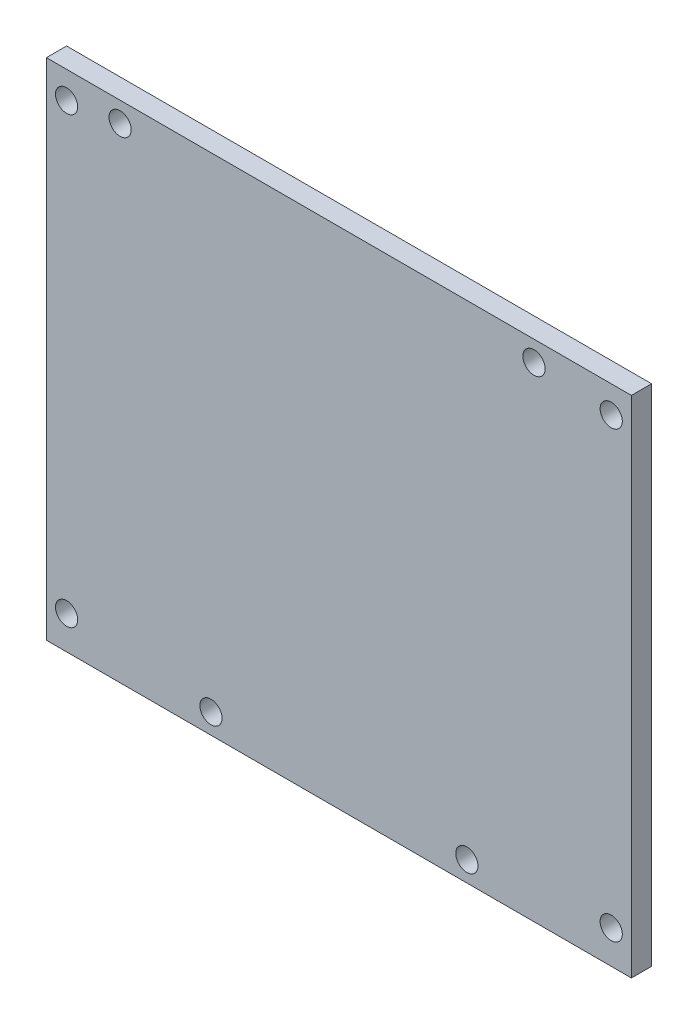
from build123d import *

# Parameters (mm, degrees)
SKETCH_1_W                 = 57.95
SKETCH_1_H                 = 49.98
COVER_2MM_DEPTH            = 2
SKETCH_2_R                 = 1.1
COVER_8XD2P2_THROUGH_DEPTH = 71.491027089


with BuildPart() as part:
    # 草图1 → Cover_2mm (new body)
    with BuildSketch(Plane.XY):
        with Locations((24.675, 20.69)):
            Rectangle(SKETCH_1_W, SKETCH_1_H)
    extrude(amount=COVER_2MM_DEPTH)


with BuildPart() as part_1:
    # Stock_Z_Position: moved
    add(part.part.moved(Location((0, 0, 11.1))))

    # 草图2 → Cover_8xD2p2_Through (cut, through all)
    with BuildSketch(Plane.XY.offset(13.1)):
        with Locations((-2.3, -1)):
            Circle(SKETCH_2_R)
        with Locations((-2.3, 43)):
            Circle(SKETCH_2_R)
        with Locations((51.65, -1)):
            Circle(SKETCH_2_R)
        with Locations((51.65, 43)):
            Circle(SKETCH_2_R)
        with Locations((12, -2.3)):
            Circle(SKETCH_2_R)
        with Locations((37.35, -2.3)):
            Circle(SKETCH_2_R)
        with Locations((3, 43.68)):
            Circle(SKETCH_2_R)
        with Locations((44, 43.68)):
            Circle(SKETCH_2_R)
    extrude(amount=-COVER_8XD2P2_THROUGH_DEPTH, mode=Mode.SUBTRACT)


solid = part_1.part
